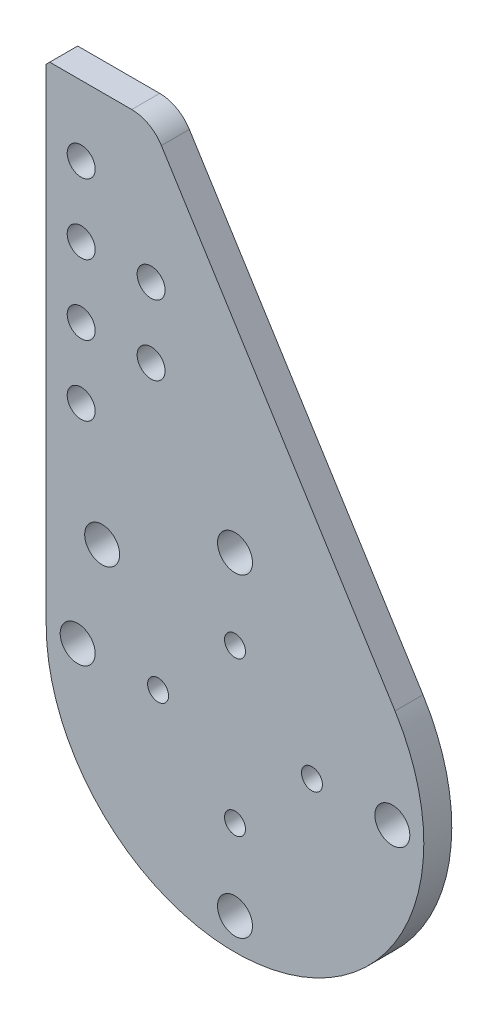
from build123d import *

# Parameters (mm, degrees)
SKETCH_1_R      = 2.5
SKETCH_1_R_2    = 2
SKETCH_1_R_3    = 1.5
EXTRUDE_1_DEPTH = 4
FILLET_1_R      = 5
CHAMFER_1_SIZE  = 0.5


with BuildPart() as part:
    # 草图1 → 凸台-拉伸1 (new body)
    with BuildSketch(Plane.XY):
        with BuildLine():
            Line((-27, 0), (-27, 70))
            Line((-27, 70), (-11.999997176, 70))
            Line((-11.999997176, 70), (22.879375353, 14.336463423))
            ThreePointArc((22.879375353, 14.336463423), (7.458447073, -25.949403987), (-27, 0))
        make_face()
        with Locations((0, 22.5)):
            Circle(SKETCH_1_R, mode=Mode.SUBTRACT)
        with Locations((22.5, 0)):
            Circle(SKETCH_1_R, mode=Mode.SUBTRACT)
        with Locations((0, -22.5)):
            Circle(SKETCH_1_R, mode=Mode.SUBTRACT)
        with Locations((-22.5, 0)):
            Circle(SKETCH_1_R, mode=Mode.SUBTRACT)
        with Locations((-22, 60)):
            Circle(SKETCH_1_R_2, mode=Mode.SUBTRACT)
        with Locations((-22, 50)):
            Circle(SKETCH_1_R_2, mode=Mode.SUBTRACT)
        with Locations((-22, 30)):
            Circle(SKETCH_1_R_2, mode=Mode.SUBTRACT)
        with Locations((-22, 40)):
            Circle(SKETCH_1_R_2, mode=Mode.SUBTRACT)
        with Locations((-12, 50)):
            Circle(SKETCH_1_R_2, mode=Mode.SUBTRACT)
        with Locations((0, 11)):
            Circle(SKETCH_1_R_3, mode=Mode.SUBTRACT)
        with Locations((11, 0)):
            Circle(SKETCH_1_R_3, mode=Mode.SUBTRACT)
        with Locations((0, -11)):
            Circle(SKETCH_1_R_3, mode=Mode.SUBTRACT)
        with Locations((-11, 0)):
            Circle(SKETCH_1_R_3, mode=Mode.SUBTRACT)
        with Locations((-12, 40)):
            Circle(SKETCH_1_R_2, mode=Mode.SUBTRACT)
        with Locations((-19, 14)):
            Circle(SKETCH_1_R, mode=Mode.SUBTRACT)
    extrude(amount=EXTRUDE_1_DEPTH)

    # 圆角1
    fillet_1_edges = [part.edges().sort_by_distance(p)[0] for p in [
        (-11.999997176, 70, 2),
    ]]
    fillet(fillet_1_edges, radius=FILLET_1_R)

    # 倒角1
    chamfer_1_edges = [part.edges().sort_by_distance(p)[0] for p in [
        (-27, 70, 2),
    ]]
    chamfer(chamfer_1_edges, length=CHAMFER_1_SIZE)


solid = part.part
